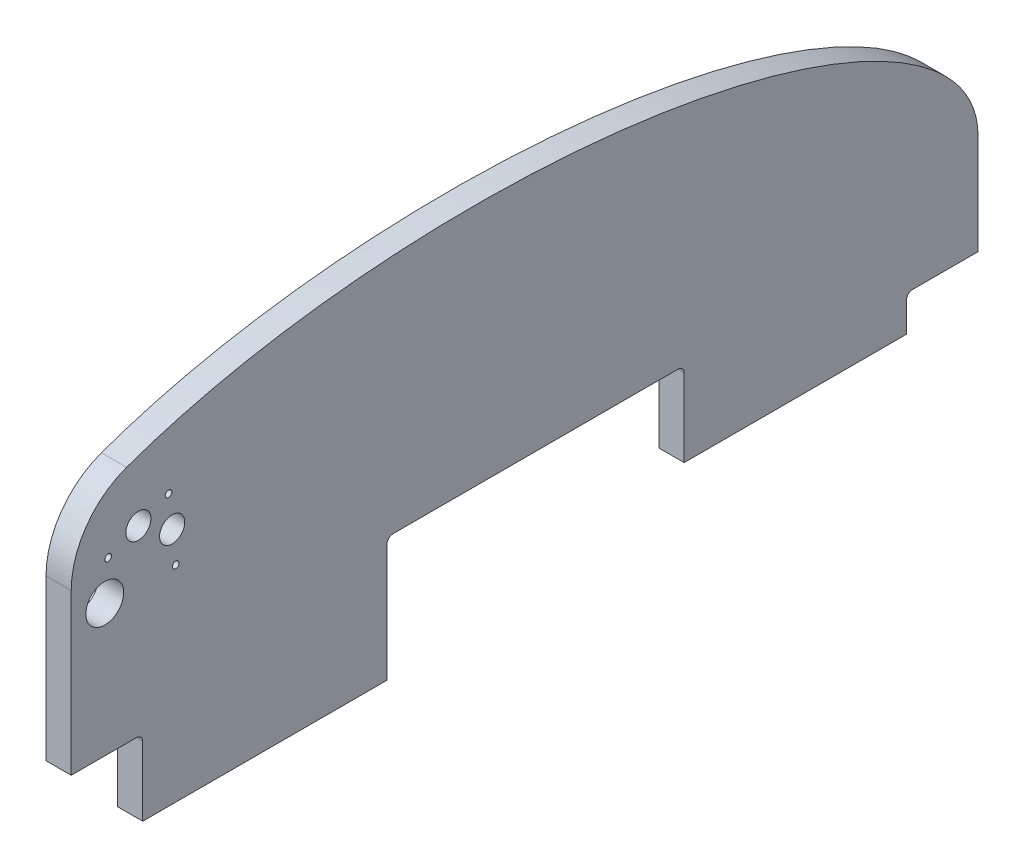
from build123d import *

# Parameters (mm, degrees)
SKETCH1_R           = 14.2875
SKETCH1_R_2         = 9.525
SKETCH1_R_3         = 2.54
BOSS_EXTRUDE1_DEPTH = 19.05
FILLET1_R           = 4.7625


with BuildPart() as part:
    # Sketch1 → Boss-Extrude1 (new body)
    with BuildSketch(Plane(origin=(0, 0, 0), x_dir=(0, 0, -1), z_dir=(1, 0, 0))):
        with BuildLine():
            Line((54.102, 134.9375), (0, 134.9375))
            Line((0, 134.9375), (0, 255.983795331))
            ThreePointArc((0, 255.983795331), (11.524561047, 292.463978248), (41.915078603, 315.702646361))
            add(Edge.make_bspline(
                [(685.8, 211.1375), (685.8, 548.429920531), (41.915078603, 315.702646361)],
                knots=[0, 0, 0, 2.332266964, 2.332266964, 2.332266964], degree=2, weights=[1, 0.393708858, 1]))
            Line((685.8, 211.1375), (685.8, 134.9375))
            Line((685.8, 134.9375), (631.698, 134.9375))
            Line((631.698, 134.9375), (631.698, 107.95))
            Line((631.698, 107.95), (463.55, 107.95))
            Line((463.55, 107.95), (463.55, 171.45))
            Line((463.55, 171.45), (238.76, 171.45))
            Line((238.76, 171.45), (238.76, 77.7875))
            Line((238.76, 77.7875), (54.102, 77.7875))
            Line((54.102, 77.7875), (54.102, 134.9375))
        make_face()
        with Locations(Location((25.4, 234.95, 0), (0, 0, 180))):
            Circle(SKETCH1_R, mode=Mode.SUBTRACT)
        with Locations(Location((50.8, 272.96523905, 0), (0, 0, 180))):
            Circle(SKETCH1_R_2, mode=Mode.SUBTRACT)
        with Locations(Location((73.66, 282.447875814, 0), (0, 0, 180))):
            Circle(SKETCH1_R_3, mode=Mode.SUBTRACT)
        with Locations(Location((27.94, 263.482602286, 0), (0, 0, 180))):
            Circle(SKETCH1_R_3, mode=Mode.SUBTRACT)
        with Locations(Location((76.372962562, 257.848285692, 0), (0, 0, 180))):
            Circle(SKETCH1_R_2, mode=Mode.SUBTRACT)
        with Locations(Location((79.085925124, 233.248695571, 0), (0, 0, 180))):
            Circle(SKETCH1_R_3, mode=Mode.SUBTRACT)
    extrude(amount=BOSS_EXTRUDE1_DEPTH)

    # Fillet1
    fillet1_edges = [part.edges().sort_by_distance(p)[0] for p in [
        (9.525, 134.9375, -631.698),
        (9.525, 171.45, -463.55),
        (9.525, 171.45, -238.76),
        (9.525, 134.9375, -54.102),
    ]]
    fillet(fillet1_edges, radius=FILLET1_R)


solid = part.part
